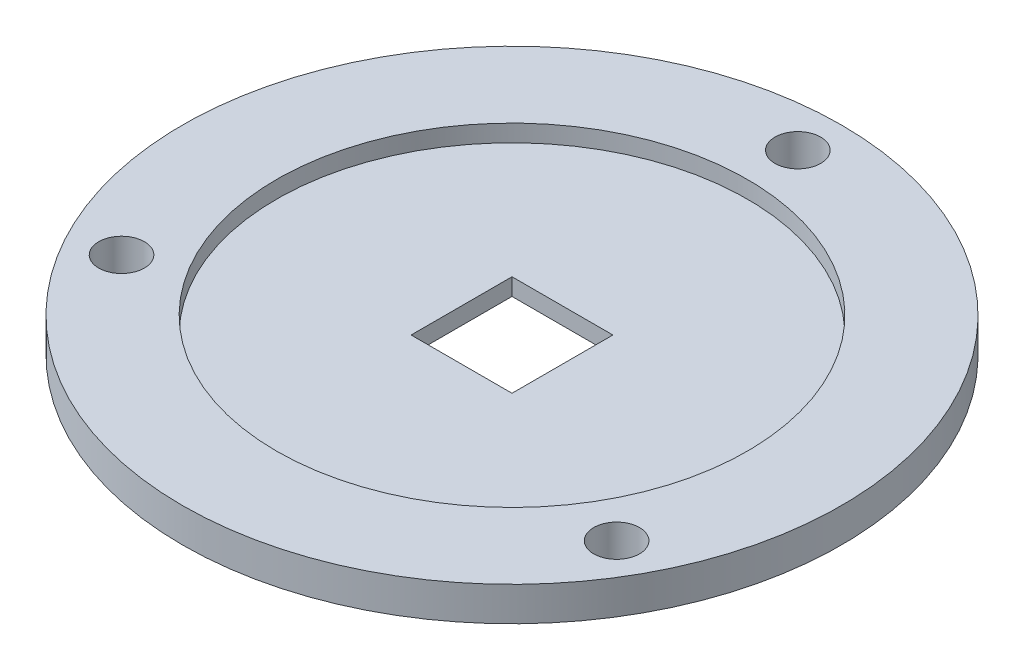
from build123d import *

# Parameters (mm, degrees)
SKETCH1_R            = 24.5
BOSS_EXTRUDE1_DEPTH  = 2.54
M3_CLEARANCE_HOLE1_D = 3.4
SKETCH4_R            = 17.5
CUT_EXTRUDE1_DEPTH   = 1.27
SKETCH5_W            = 7.5
SKETCH5_H            = 7.5
CUT_EXTRUDE2_DEPTH   = 1.27


with BuildPart() as part:
    # Sketch1 → Boss-Extrude1 (new body)
    with BuildSketch(Plane(origin=(0, 0, 0), x_dir=(1, 0, 0), z_dir=(0, 1, 0))):
        with Locations(Location((0, 0, 0), (0, 0, 270))):
            Circle(SKETCH1_R)
    extrude(amount=BOSS_EXTRUDE1_DEPTH)

    # M3 Clearance Hole1 (through all)
    with Locations(Plane(origin=(-18.40303983, 2.54, 10.625), x_dir=(0, 0, 1), z_dir=(0, 1, 0))):
        with Locations((0, 0), (0, 36.80607966), (-31.875, 18.40303983)):
            Hole(M3_CLEARANCE_HOLE1_D / 2)

    # Sketch4 → Cut-Extrude1 (cut)
    with BuildSketch(Plane(origin=(0, 2.54, 0), x_dir=(1, 0, 0), z_dir=(0, 1, 0))):
        with Locations(Location((0, 0, 0), (0, 0, 270))):
            Circle(SKETCH4_R)
    extrude(amount=-CUT_EXTRUDE1_DEPTH, mode=Mode.SUBTRACT)

    # Sketch5 → Cut-Extrude2 (cut)
    with BuildSketch(Plane(origin=(0, 1.27, 0), x_dir=(1, 0, 0), z_dir=(0, 1, 0))):
        Rectangle(SKETCH5_W, SKETCH5_H)
    extrude(amount=-CUT_EXTRUDE2_DEPTH, mode=Mode.SUBTRACT)


solid = part.part
